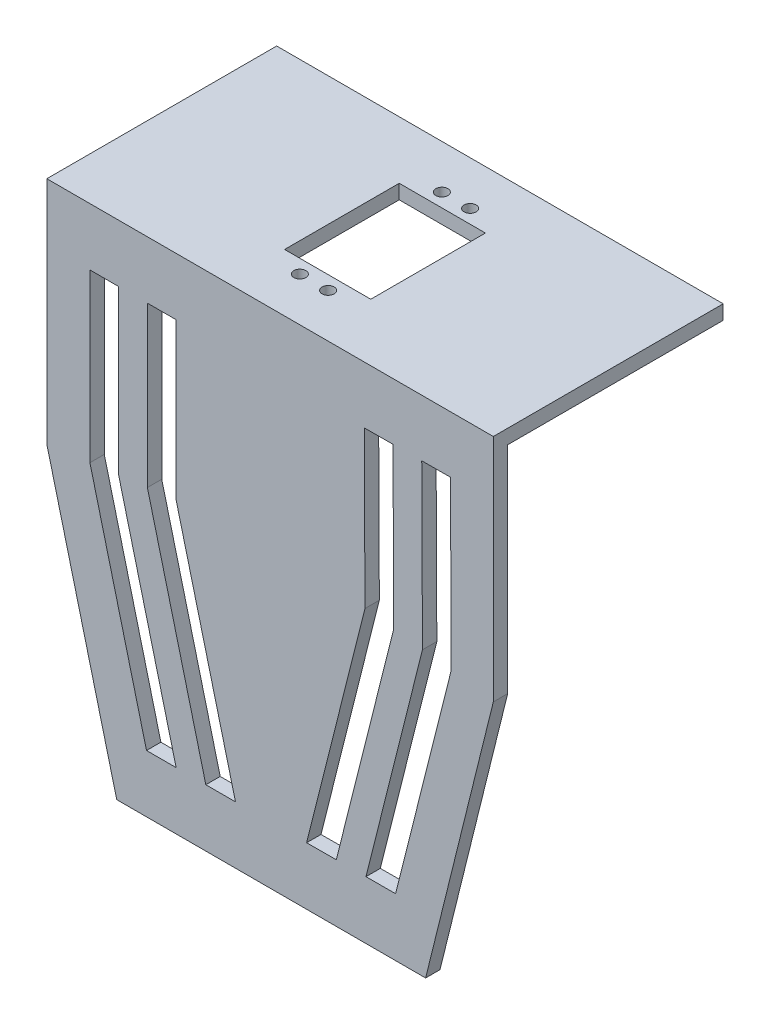
from build123d import *

# Parameters (mm, degrees)
SKETCH1_W           = 155.4
SKETCH1_H           = 80
BOSS_EXTRUDE1_DEPTH = 5
SKETCH2_W           = 155.4
SKETCH2_H           = 5
BOSS_EXTRUDE2_DEPTH = 75
BOSS_EXTRUDE3_DEPTH = 5
CUT_EXTRUDE2_REACH  = 249.334
SKETCH7_R           = 2.1
CUT_EXTRUDE3_REACH  = 245.822


with BuildPart() as part:
    # Sketch1 → Boss-Extrude1 (new body)
    with BuildSketch(Plane(origin=(0, 0, 0), x_dir=(1, 0, 0), z_dir=(0, 1, 0))):
        with Locations((77.7, 40)):
            Rectangle(SKETCH1_W, SKETCH1_H)
    extrude(amount=BOSS_EXTRUDE1_DEPTH)

    # Sketch2 → Boss-Extrude2 (add)
    with BuildSketch(Plane.XZ):
        with Locations((77.7, -2.5)):
            Rectangle(SKETCH2_W, SKETCH2_H)
    extrude(amount=BOSS_EXTRUDE2_DEPTH)

    # Sketch4 → Boss-Extrude3 (add)
    with BuildSketch(Plane.XY):
        Polygon((131.839983018, -170), (155.4, -75), (0.768966036, -75), (0, -75), (24.328983018, -170), (26.154336071, -170), align=None)
    extrude(amount=-BOSS_EXTRUDE3_DEPTH)

    # Sketch7 → Cut-Extrude2 (cut, up to next)
    with BuildSketch(Plane(origin=(0, 5, 0), x_dir=(1, 0, 0), z_dir=(0, 1, 0)), mode=Mode.PRIVATE) as cut_extrude2_sk1:
        with BuildLine():
            Line((92.7, 20.05), (92.7, 59.95))
            Line((92.7, 59.95), (77.7, 59.95))
            Line((77.7, 59.95), (77.7, 36.45))
            ThreePointArc((77.7, 36.45), (82.331549417, 34.531549417), (84.25, 29.9))
            ThreePointArc((84.25, 29.9), (82.331549417, 25.268450583), (77.7, 23.35))
            Line((77.7, 23.35), (77.7, 20.05))
            Line((77.7, 20.05), (92.7, 20.05))
        make_face()
    cut_extrude2_tool1 = extrude(cut_extrude2_sk1.sketch, amount=-CUT_EXTRUDE2_REACH, mode=Mode.PRIVATE) & part.part
    # Sketch7 → Cut-Extrude2 (cut, up to next)
    with BuildSketch(Plane(origin=(0, 5, 0), x_dir=(1, 0, 0), z_dir=(0, 1, 0)), mode=Mode.PRIVATE) as cut_extrude2_sk2:
        with BuildLine():
            Line((77.7, 36.45), (77.7, 59.95))
            Line((77.7, 59.95), (62.7, 59.95))
            Line((62.7, 59.95), (62.7, 20.05))
            Line((62.7, 20.05), (77.7, 20.05))
            Line((77.7, 20.05), (77.7, 23.35))
            ThreePointArc((77.7, 23.35), (71.15, 29.9), (77.7, 36.45))
        make_face()
    cut_extrude2_tool2 = extrude(cut_extrude2_sk2.sketch, amount=-CUT_EXTRUDE2_REACH, mode=Mode.PRIVATE) & part.part
    # Sketch7 → Cut-Extrude2 (cut, up to next)
    with BuildSketch(Plane(origin=(0, 5, 0), x_dir=(1, 0, 0), z_dir=(0, 1, 0)), mode=Mode.PRIVATE) as cut_extrude2_sk3:
        with BuildLine():
            ThreePointArc((84.25, 29.9), (82.331549417, 34.531549417), (77.7, 36.45))
            Line((77.7, 36.45), (77.7, 23.35))
            ThreePointArc((77.7, 23.35), (82.331549417, 25.268450583), (84.25, 29.9))
        make_face()
    cut_extrude2_tool3 = extrude(cut_extrude2_sk3.sketch, amount=-CUT_EXTRUDE2_REACH, mode=Mode.PRIVATE) & part.part
    # Sketch7 → Cut-Extrude2 (cut, up to next)
    with BuildSketch(Plane(origin=(0, 5, 0), x_dir=(1, 0, 0), z_dir=(0, 1, 0)), mode=Mode.PRIVATE) as cut_extrude2_sk4:
        with BuildLine():
            Line((77.7, 23.35), (77.7, 36.45))
            ThreePointArc((77.7, 36.45), (71.15, 29.9), (77.7, 23.35))
        make_face()
    cut_extrude2_tool4 = extrude(cut_extrude2_sk4.sketch, amount=-CUT_EXTRUDE2_REACH, mode=Mode.PRIVATE) & part.part
    # Sketch7 → Cut-Extrude2 (cut, up to next)
    with BuildSketch(Plane(origin=(0, 5, 0), x_dir=(1, 0, 0), z_dir=(0, 1, 0)), mode=Mode.PRIVATE) as cut_extrude2_sk5:
        with BuildLine():
            ThreePointArc((84.25, 29.9), (82.331549417, 34.531549417), (77.7, 36.45))
            Line((77.7, 36.45), (77.7, 23.35))
            ThreePointArc((77.7, 23.35), (82.331549417, 25.268450583), (84.25, 29.9))
        make_face()
    cut_extrude2_tool5 = extrude(cut_extrude2_sk5.sketch, amount=-CUT_EXTRUDE2_REACH, mode=Mode.PRIVATE) & part.part
    # Sketch7 → Cut-Extrude2 (cut, up to next)
    with BuildSketch(Plane(origin=(0, 5, 0), x_dir=(1, 0, 0), z_dir=(0, 1, 0)), mode=Mode.PRIVATE) as cut_extrude2_sk6:
        with BuildLine():
            Line((77.7, 23.35), (77.7, 36.45))
            ThreePointArc((77.7, 36.45), (71.15, 29.9), (77.7, 23.35))
        make_face()
    cut_extrude2_tool6 = extrude(cut_extrude2_sk6.sketch, amount=-CUT_EXTRUDE2_REACH, mode=Mode.PRIVATE) & part.part
    # Sketch7 → Cut-Extrude2 (cut, up to next)
    with BuildSketch(Plane(origin=(0, 5, 0), x_dir=(1, 0, 0), z_dir=(0, 1, 0)), mode=Mode.PRIVATE) as cut_extrude2_sk7:
        with Locations(Location((82.625, 15.288854382, 0), (0, 0, 270))):
            Circle(SKETCH7_R)
    cut_extrude2_tool7 = extrude(cut_extrude2_sk7.sketch, amount=-CUT_EXTRUDE2_REACH, mode=Mode.PRIVATE) & part.part
    # Sketch7 → Cut-Extrude2 (cut, up to next)
    with BuildSketch(Plane(origin=(0, 5, 0), x_dir=(1, 0, 0), z_dir=(0, 1, 0)), mode=Mode.PRIVATE) as cut_extrude2_sk8:
        with Locations(Location((72.775, 15.288854382, 0), (0, 0, 270))):
            Circle(SKETCH7_R)
    cut_extrude2_tool8 = extrude(cut_extrude2_sk8.sketch, amount=-CUT_EXTRUDE2_REACH, mode=Mode.PRIVATE) & part.part
    # Sketch7 → Cut-Extrude2 (cut, up to next)
    with BuildSketch(Plane(origin=(0, 5, 0), x_dir=(1, 0, 0), z_dir=(0, 1, 0)), mode=Mode.PRIVATE) as cut_extrude2_sk9:
        with Locations(Location((72.775, 64.711145618, 0), (0, 0, 270))):
            Circle(SKETCH7_R)
    cut_extrude2_tool9 = extrude(cut_extrude2_sk9.sketch, amount=-CUT_EXTRUDE2_REACH, mode=Mode.PRIVATE) & part.part
    # Sketch7 → Cut-Extrude2 (cut, up to next)
    with BuildSketch(Plane(origin=(0, 5, 0), x_dir=(1, 0, 0), z_dir=(0, 1, 0)), mode=Mode.PRIVATE) as cut_extrude2_sk10:
        with Locations(Location((82.625, 64.711145618, 0), (0, 0, 270))):
            Circle(SKETCH7_R)
    cut_extrude2_tool10 = extrude(cut_extrude2_sk10.sketch, amount=-CUT_EXTRUDE2_REACH, mode=Mode.PRIVATE) & part.part
    add(cut_extrude2_tool1.solids().sort_by_distance((85.798921, 5, -41.281564))[0], mode=Mode.SUBTRACT)
    add(cut_extrude2_tool2.solids().sort_by_distance((69.601079, 5, -41.281564))[0], mode=Mode.SUBTRACT)
    add(cut_extrude2_tool3.solids().sort_by_distance((80.479906, 5, -29.9))[0], mode=Mode.SUBTRACT)
    add(cut_extrude2_tool4.solids().sort_by_distance((74.920094, 5, -29.9))[0], mode=Mode.SUBTRACT)
    add(cut_extrude2_tool5.solids().sort_by_distance((80.479906, 5, -29.9))[0], mode=Mode.SUBTRACT)
    add(cut_extrude2_tool6.solids().sort_by_distance((74.920094, 5, -29.9))[0], mode=Mode.SUBTRACT)
    add(cut_extrude2_tool7.solids().sort_by_distance((82.625, 5, -15.288854))[0], mode=Mode.SUBTRACT)
    add(cut_extrude2_tool8.solids().sort_by_distance((72.775, 5, -15.288854))[0], mode=Mode.SUBTRACT)
    add(cut_extrude2_tool9.solids().sort_by_distance((72.775, 5, -64.711146))[0], mode=Mode.SUBTRACT)
    add(cut_extrude2_tool10.solids().sort_by_distance((82.625, 5, -64.711146))[0], mode=Mode.SUBTRACT)

    # Sketch8 → Cut-Extrude3 (cut, up to next)
    with BuildSketch(Plane.XY, mode=Mode.PRIVATE) as cut_extrude3_sk1:
        Polygon((25, -71.849651243), (25, -15), (15, -15), (15, -73.109790746), (34.69116416, -150), (45.013879029, -150), align=None)
    cut_extrude3_tool1 = extrude(cut_extrude3_sk1.sketch, amount=-CUT_EXTRUDE3_REACH, mode=Mode.PRIVATE) & part.part
    # Sketch8 → Cut-Extrude3 (cut, up to next)
    with BuildSketch(Plane.XY, mode=Mode.PRIVATE) as cut_extrude3_sk2:
        Polygon((45, -15), (35, -15), (35, -70.589511741), (55.336593898, -150), (65.659308767, -150), (45, -69.329372238), align=None)
    cut_extrude3_tool2 = extrude(cut_extrude3_sk2.sketch, amount=-CUT_EXTRUDE3_REACH, mode=Mode.PRIVATE) & part.part
    # Sketch8 → Cut-Extrude3 (cut, up to next)
    with BuildSketch(Plane.XY, mode=Mode.PRIVATE) as cut_extrude3_sk3:
        Polygon((90.421655908, -149.945595989), (100.744271122, -149.900237253), (120.731733413, -70.401155194), (120.487469184, -14.812180114), (110.487565723, -14.856120818), (110.726292811, -69.184968561), align=None)
    cut_extrude3_tool3 = extrude(cut_extrude3_sk3.sketch, amount=-CUT_EXTRUDE3_REACH, mode=Mode.PRIVATE) & part.part
    # Sketch8 → Cut-Extrude3 (cut, up to next)
    with BuildSketch(Plane.XY, mode=Mode.PRIVATE) as cut_extrude3_sk4:
        Polygon((111.066886336, -149.854878517), (121.389501549, -149.809519781), (140.742614617, -72.833528461), (140.487276104, -14.724298705), (130.487372644, -14.768239409), (130.737174015, -71.617341828), align=None)
    cut_extrude3_tool4 = extrude(cut_extrude3_sk4.sketch, amount=-CUT_EXTRUDE3_REACH, mode=Mode.PRIVATE) & part.part
    add(cut_extrude3_tool1.solids().sort_by_distance((25.777168, -83.022875, 0))[0], mode=Mode.SUBTRACT)
    add(cut_extrude3_tool2.solids().sort_by_distance((46.155254, -83.015898, 0))[0], mode=Mode.SUBTRACT)
    add(cut_extrude3_tool3.solids().sort_by_distance((109.631189, -82.876438, 0))[0], mode=Mode.SUBTRACT)
    add(cut_extrude3_tool4.solids().sort_by_distance((130.00911, -82.793873, 0))[0], mode=Mode.SUBTRACT)


solid = part.part
